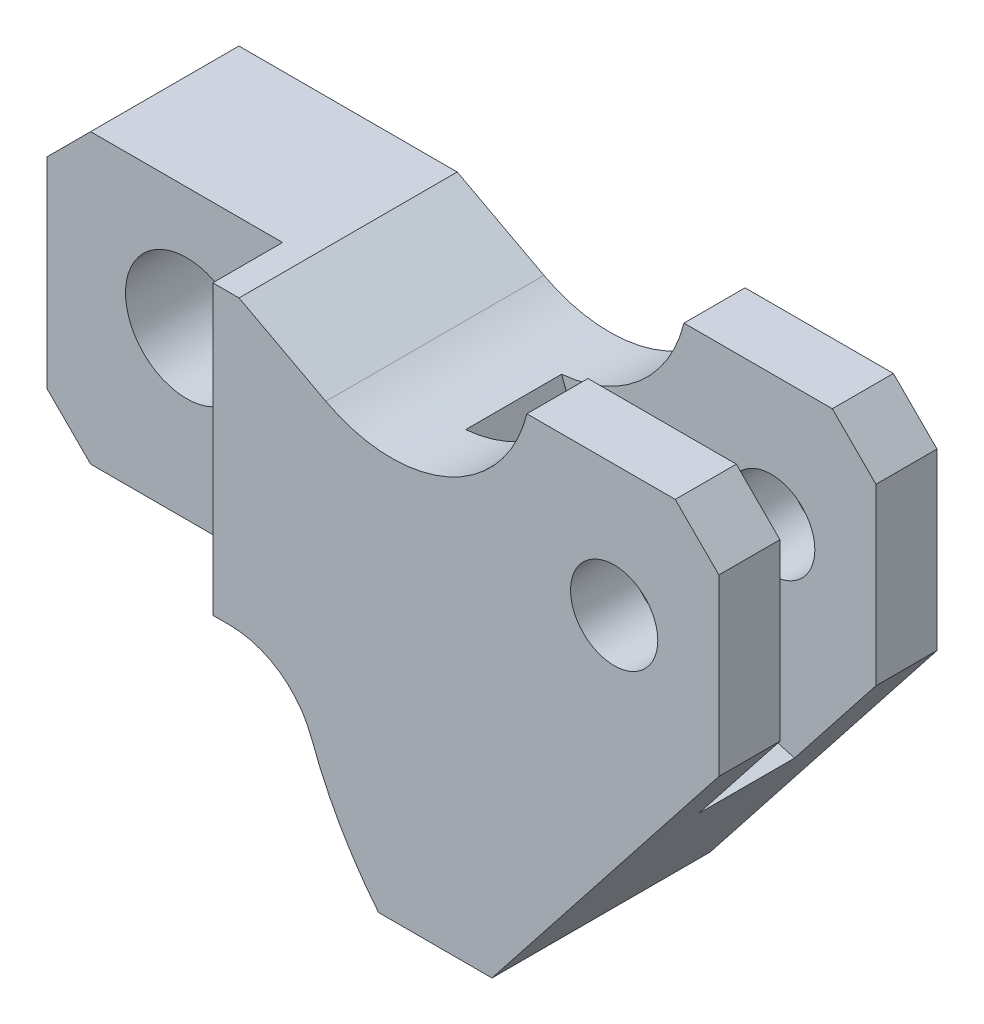
from build123d import *
from build123d.topology import SkipClean

# Parameters (mm, degrees)
BOSS_EXTRUDE1_START = -12.5
SKETCH1_W           = 27
SKETCH1_H           = 33
SKETCH1_R           = 7
BOSS_EXTRUDE1_DEPTH = 17
BOSS_EXTRUDE3_DEPTH = 12.5
BOSS_EXTRUDE4_START = 12.5
SKETCH1_5_R         = 5
BOSS_EXTRUDE4_DEPTH = 7
CHAMFER1_SIZE       = 5


with BuildPart() as part:
    # Sketch1 → Boss-Extrude1 (new body)
    with BuildSketch(Plane.XY.offset(BOSS_EXTRUDE1_START)):
        with Locations((-33.967633793, -25.34)):
            Rectangle(SKETCH1_W, SKETCH1_H)
        with Locations((-31.467633793, -22.84)):
            Circle(SKETCH1_R, mode=Mode.SUBTRACT)
    extrude(amount=BOSS_EXTRUDE1_DEPTH)

    # Sketch1<4> → Boss-Extrude3 (add, symmetric)
    with BuildSketch(Plane.XY):
        with BuildLine():
            ThreePointArc((28.205719919, -40.677666444), (11.699513519, -31.708687123), (1.506567213, -15.928912557))
            ThreePointArc((1.506567213, -15.928912557), (-3.134727468, -15.689916625), (-7.511545005, -14.127161486))
            Line((-7.511545005, -14.127161486), (-17.455249537, -8.84))
            Line((-17.455249537, -8.84), (-20.467633793, -8.84))
            Line((-20.467633793, -8.84), (-20.467633793, -41.84))
            Line((-20.467633793, -41.84), (-18.535800645, -41.84))
            ThreePointArc((-18.535800645, -41.84), (-12.817002571, -43.63662578), (-9.153112508, -48.38093028))
            ThreePointArc((-9.153112508, -48.38093028), (-5.868981967, -55.429445297), (-1.467633793, -61.84))
            Line((-1.467633793, -61.84), (11.532366207, -61.84))
            Line((11.532366207, -61.84), (28.205719919, -40.677666444))
        make_face()
    extrude(amount=BOSS_EXTRUDE3_DEPTH, both=True)

    # Sketch1<5> → Boss-Extrude4 (add)
    with BuildSketch(Plane.XY.offset(BOSS_EXTRUDE4_START)):
        with BuildLine():
            Line((37.532366207, -3.84), (15.532366207, -3.84))
            ThreePointArc((15.532366207, -3.84), (10.445897028, -12.1195394), (1.506567213, -15.928912557))
            ThreePointArc((1.506567213, -15.928912557), (11.699513519, -31.708687123), (28.205719919, -40.677666444))
            Line((28.205719919, -40.677666444), (37.532366207, -28.84))
            Line((37.532366207, -28.84), (37.532366207, -3.84))
        make_face()
        with Locations((25.532366207, -18.84)):
            Circle(SKETCH1_5_R, mode=Mode.SUBTRACT)
    boss_extrude4 = extrude(amount=-BOSS_EXTRUDE4_DEPTH)

    # Mirror1: Boss-Extrude4 across plane
    with SkipClean():  # the faces are left unmerged after this step: merging them gives an invalid solid
        add(boss_extrude4.mirror(Plane.XY))

    # Chamfer1
    chamfer1_edges = [part.edges().sort_by_distance(p)[0] for p in [
        (37.532366207, -3.84, 9),
        (37.532366207, -3.84, -9),
        (-47.467633793, -41.84, -4),
        (-47.467633793, -8.84, -4),
    ]]
    chamfer(chamfer1_edges, length=CHAMFER1_SIZE)


solid = part.part
